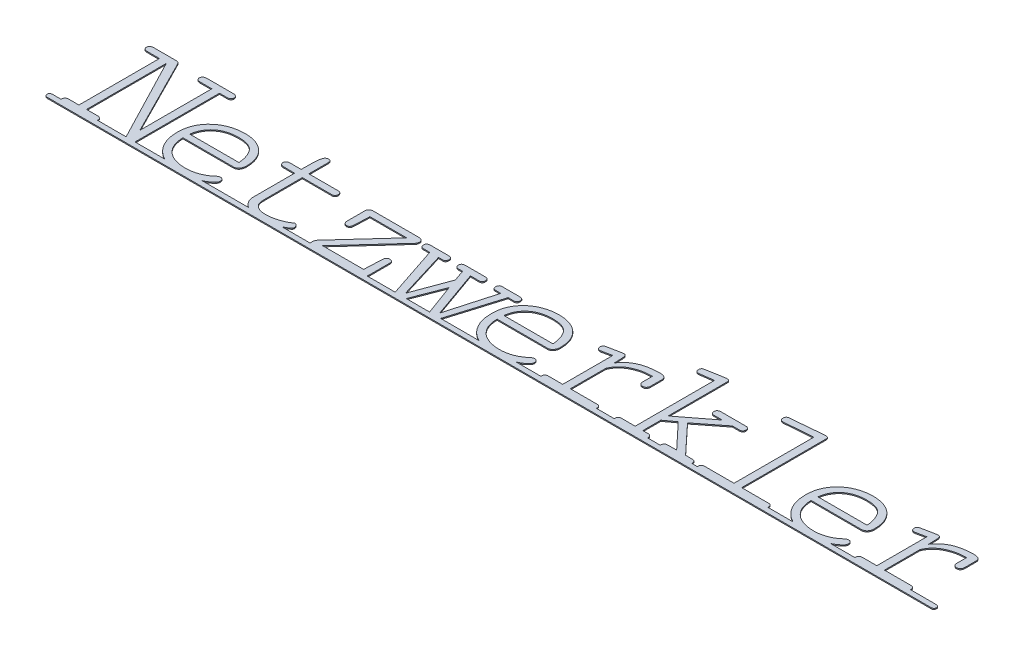
from build123d import *

# Parameters (mm, degrees)
AUFSATZ_LINEAR_AUSTRAGEN1_DEPTH    = 1
AUFSATZ_LINEAR_AUSTRAGEN1_2_DEPTH  = 1
AUFSATZ_LINEAR_AUSTRAGEN1_3_DEPTH  = 1
AUFSATZ_LINEAR_AUSTRAGEN1_4_DEPTH  = 1
AUFSATZ_LINEAR_AUSTRAGEN1_5_DEPTH  = 1
AUFSATZ_LINEAR_AUSTRAGEN1_6_DEPTH  = 1
AUFSATZ_LINEAR_AUSTRAGEN1_7_DEPTH  = 1
AUFSATZ_LINEAR_AUSTRAGEN1_8_DEPTH  = 1
AUFSATZ_LINEAR_AUSTRAGEN1_9_DEPTH  = 1
AUFSATZ_LINEAR_AUSTRAGEN1_10_DEPTH = 1
AUFSATZ_LINEAR_AUSTRAGEN1_11_DEPTH = 1
AUFSATZ_LINEAR_AUSTRAGEN3_DEPTH    = 1


with BuildPart() as part:
    # Skizze2 → Aufsatz-Linear austragen1 (new body)
    with BuildSketch(Plane(origin=(0, 0, 0), x_dir=(1, 0, 0), z_dir=(0, 1, 0))):
        with BuildLine():
            Line((21.819556452, 6.282762097), (12.179939516, 6.282762097))
            add(Edge.make_bspline(
                [(12.179939516, 6.282762097), (11.645265853, 6.252695795), (10.635808937, 6.19593101), (9.396362367, 5.421695162), (8.569459607, 4.373908894), (8.465197041, 3.550556393), (8.414818548, 3.152721774)],
                knots=[0, 0, 0, 0, 1.163915041, 2.197456445, 3.129031336, 4, 4, 4, 4], degree=3))
            add(Edge.make_bspline(
                [(8.414818548, 3.152721774), (8.461731539, 2.731819028), (8.556148513, 1.884711156), (9.384826392, 0.810331613), (10.671421694, 0.087707641), (11.692428496, 0.030906774), (12.247983871, 0)],
                knots=[0, 0, 0, 0, 0.9015604, 1.814478327, 2.810802915, 4, 4, 4, 4], degree=3))
            Line((12.247983871, 0), (39.647177419, 0))
            add(Edge.make_bspline(
                [(39.647177419, 0), (40.202732794, 0.030906774), (41.223739596, 0.087707641), (42.510334898, 0.810331613), (43.339012777, 1.884711156), (43.433429751, 2.731819028), (43.480342742, 3.152721774)],
                knots=[0, 0, 0, 0, 1.189197085, 2.185521673, 3.0984396, 4, 4, 4, 4], degree=3))
            add(Edge.make_bspline(
                [(43.480342742, 3.152721774), (43.430075448, 3.550743147), (43.326043018, 4.37448215), (42.501419824, 5.413850496), (41.278251541, 6.201204681), (40.273538702, 6.254401599), (39.737903226, 6.282762097)],
                knots=[0, 0, 0, 0, 0.874083582, 1.808990141, 2.831922353, 4, 4, 4, 4], degree=3))
            Line((39.737903226, 6.282762097), (29.168346774, 6.282762097))
            Line((29.168346774, 6.282762097), (29.168346774, 82.923387097))
            Line((29.168346774, 82.923387097), (71.491935484, 1.474294355))
            add(Edge.make_bspline(
                [(71.491935484, 1.474294355), (71.742219087, 1.048617155), (72.233029237, 0.213857354), (73.318712485, -0.71190596), (74.522789088, -1.309205283), (75.372284684, -1.40552722), (75.778729839, -1.451612903)],
                knots=[0, 0, 0, 0, 1.083340728, 2.124448505, 3.102633586, 4, 4, 4, 4], degree=3))
            add(Edge.make_bspline(
                [(75.778729839, -1.451612903), (76.038723219, -1.444027576), (76.549277302, -1.429132121), (77.255157475, -1.148401844), (77.924396552, -0.7910496), (78.488850958, -0.226111358), (78.969543803, 0.477158807), (79.306338917, 1.337272053), (79.512367884, 2.33401716), (79.532908058, 3.045733384), (79.543850806, 3.424899194)],
                knots=[0, 0, 0, 0, 0.894329064, 1.756211463, 2.601200456, 3.509242349, 4.490331309, 5.536444168, 6.687544121, 8, 8, 8, 8], degree=3))
            Line((79.543850806, 3.424899194), (79.543850806, 83.717237903))
            Line((79.543850806, 83.717237903), (86.892641129, 83.717237903))
            add(Edge.make_bspline(
                [(86.892641129, 83.717237903), (87.41842002, 83.749609872), (88.396829872, 83.809850123), (89.618686185, 84.535892322), (90.412980319, 85.570407315), (90.516406647, 86.381959709), (90.56703629, 86.779233871)],
                knots=[0, 0, 0, 0, 1.172493546, 2.181866286, 3.109980388, 4, 4, 4, 4], degree=3))
            add(Edge.make_bspline(
                [(90.56703629, 86.779233871), (90.521917476, 87.202181101), (90.429475524, 88.068739045), (89.544488696, 89.124187501), (88.296652159, 89.919051459), (87.277341749, 89.971849439), (86.733870968, 90)],
                knots=[0, 0, 0, 0, 0.897788018, 1.839438313, 2.848042621, 4, 4, 4, 4], degree=3))
            Line((86.733870968, 90), (60.945060484, 90))
            add(Edge.make_bspline(
                [(60.945060484, 90), (60.388572277, 89.970356917), (59.344950063, 89.914765119), (58.045158816, 89.147417698), (57.190851628, 88.057109377), (57.07709516, 87.200410548), (57.021169355, 86.779233871)],
                knots=[0, 0, 0, 0, 1.168472526, 2.191320264, 3.110803358, 4, 4, 4, 4], degree=3))
            add(Edge.make_bspline(
                [(57.021169355, 86.779233871), (57.070670181, 86.38128786), (57.17235425, 85.563831399), (58.000151315, 84.527256131), (59.256238851, 83.815171978), (60.253821701, 83.751319647), (60.786290323, 83.717237903)],
                knots=[0, 0, 0, 0, 0.877608716, 1.802774489, 2.827211556, 4, 4, 4, 4], degree=3))
            Line((60.786290323, 83.717237903), (72.195060484, 83.717237903))
            Line((72.195060484, 83.717237903), (72.195060484, 14.584173387))
            Line((72.195060484, 14.584173387), (34.974798387, 88.140120968))
            add(Edge.make_bspline(
                [(34.974798387, 88.140120968), (34.818638086, 88.439541393), (34.530511621, 88.991992612), (33.840159642, 89.622671689), (32.937114371, 89.951152977), (32.278577647, 89.982557041), (31.912802419, 90)],
                knots=[0, 0, 0, 0, 1.052313138, 1.941589905, 2.856684229, 4, 4, 4, 4], degree=3))
            Line((31.912802419, 90), (9.957157258, 90))
            add(Edge.make_bspline(
                [(9.957157258, 90), (9.415255524, 89.969679628), (8.392311067, 89.912444054), (7.124450111, 89.139127656), (6.265421608, 88.06034797), (6.170545961, 87.200934761), (6.123991935, 86.779233871)],
                knots=[0, 0, 0, 0, 1.150747229, 2.172258226, 3.103155123, 4, 4, 4, 4], degree=3))
            add(Edge.make_bspline(
                [(6.123991935, 86.779233871), (6.173393449, 86.381107973), (6.274873513, 85.56328199), (7.100037501, 84.535037725), (8.340450628, 83.809925432), (9.333067986, 83.749634209), (9.866431452, 83.717237903)],
                knots=[0, 0, 0, 0, 0.880824776, 1.809380884, 2.822913789, 4, 4, 4, 4], degree=3))
            Line((9.866431452, 83.717237903), (21.819556452, 83.717237903))
            Line((21.819556452, 83.717237903), (21.819556452, 6.282762097))
        make_face()
    extrude(amount=AUFSATZ_LINEAR_AUSTRAGEN1_DEPTH)



with BuildPart() as body_2:
    # Skizze2 → Aufsatz-Linear austragen1 2 (new body)
    with BuildSketch(Plane(origin=(0, 0, 0), x_dir=(1, 0, 0), z_dir=(0, 1, 0))):
        with BuildLine():
            add(Edge.make_bspline(
                [(91.723790323, 31.186995968), (91.772864812, 29.557899597), (91.868251557, 26.391403126), (92.69811115, 21.820272208), (94.063596474, 17.588791012), (95.975580248, 13.715077511), (98.38340923, 10.229155345), (101.261765132, 7.177150843), (104.55666121, 4.544102829), (108.280959303, 2.365961435), (112.368567164, 0.64474108), (116.781874176, -0.575943451), (121.487404494, -1.311863251), (124.722592019, -1.404251733), (126.381048387, -1.451612903)],
                knots=[0, 0, 0, 0, 1.091518764, 2.121599665, 3.102620066, 4.063796307, 5.007287007, 5.932476585, 6.866607136, 7.825495065, 8.815899445, 9.831776676, 10.888502211, 12, 12, 12, 12], degree=3))
            add(Edge.make_bspline(
                [(126.381048387, -1.451612903), (127.486504315, -1.419726848), (129.75244471, -1.35436748), (133.194495001, -0.847698415), (136.757562018, -0.072111471), (140.348623515, 0.990079711), (143.797343523, 2.308039154), (146.906970793, 3.861959613), (149.589435987, 5.652717999), (151.083588878, 7.070609999), (151.806955645, 7.757056452)],
                knots=[0, 0, 0, 0, 0.959260595, 1.966272266, 3.014093297, 4.122943806, 5.213721629, 6.214555519, 7.135609743, 8, 8, 8, 8], degree=3))
            add(Edge.make_bspline(
                [(151.806955645, 7.757056452), (152.212918187, 8.254261514), (152.974124834, 9.186553928), (153.121667957, 10.376928926), (153.190524194, 10.932459677)],
                knots=[0, 0, 0, 0, 1.066629001, 2, 2, 2, 2], degree=3))
            add(Edge.make_bspline(
                [(153.190524194, 10.932459677), (153.157792058, 11.366803518), (153.093188699, 12.224067195), (152.387386113, 13.302441), (151.385313128, 14.110694865), (150.551314454, 14.199123641), (150.128528226, 14.243951613)],
                knots=[0, 0, 0, 0, 1.028187244, 2.029331365, 3.000991744, 4, 4, 4, 4], degree=3))
            add(Edge.make_bspline(
                [(150.128528226, 14.243951613), (149.59175222, 14.177008193), (148.43260266, 14.032446152), (147.484736943, 13.343630818), (146.975806452, 12.973790323)],
                knots=[0, 0, 0, 0, 0.926154873, 2, 2, 2, 2], degree=3))
            add(Edge.make_bspline(
                [(146.975806452, 12.973790323), (146.241593947, 12.320644746), (144.782748271, 11.022875241), (142.341470637, 9.39756482), (139.780896968, 7.984122466), (137.08418884, 6.8264824), (134.304788445, 5.957583891), (131.48520979, 5.309827618), (128.637604925, 4.916456221), (126.722450174, 4.85951001), (125.768649194, 4.831149194)],
                knots=[0, 0, 0, 0, 1.013539612, 2.013855485, 3.020033019, 4.030712624, 5.038009999, 6.022761418, 7.015279524, 8, 8, 8, 8], degree=3))
            add(Edge.make_bspline(
                [(125.768649194, 4.831149194), (124.807549787, 4.845217311), (122.933464301, 4.872649286), (120.197948797, 5.183721928), (117.599787746, 5.645775489), (115.143590853, 6.333311277), (112.820249183, 7.194748347), (110.627196111, 8.238886578), (108.577873704, 9.487055296), (106.694463695, 10.94242071), (104.98090073, 12.57668086), (103.485033957, 14.403611956), (102.167618323, 16.390694689), (101.111170115, 18.577442335), (100.266242553, 20.943510981), (99.636780488, 23.480783167), (99.226905987, 26.200157982), (99.124977875, 28.070690791), (99.072580645, 29.032258065)],
                knots=[0, 0, 0, 0, 1.13417738, 2.211577025, 3.246273848, 4.246794185, 5.218387413, 6.168587881, 7.110069762, 8.045608957, 8.973623357, 9.899359785, 10.827760455, 11.781852031, 12.758761032, 13.789252614, 14.863541806, 16, 16, 16, 16], degree=3))
            Line((99.072580645, 29.032258065), (147.202620968, 29.032258065))
            add(Edge.make_bspline(
                [(147.202620968, 29.032258065), (147.628539126, 29.051386302), (148.459377098, 29.088699728), (149.638798144, 29.457098602), (150.663375812, 30.093254056), (151.53317954, 30.947601785), (152.234867306, 31.990420437), (152.724072591, 33.189262675), (153.068797206, 34.509664118), (153.089164463, 35.441105588), (153.099798387, 35.927419355)],
                knots=[0, 0, 0, 0, 1.001547663, 1.953717663, 2.873336758, 3.818146233, 4.806296796, 5.812112773, 6.857684876, 8, 8, 8, 8], degree=3))
            add(Edge.make_bspline(
                [(153.099798387, 35.927419355), (153.057392912, 37.291071945), (152.975349002, 39.929396082), (152.312213671, 43.730466434), (151.206142309, 47.219425913), (149.628699627, 50.370620724), (147.657342691, 53.169198141), (145.384357402, 55.664086689), (142.71485747, 57.732854383), (139.747995785, 59.43517571), (136.515654306, 60.778277188), (133.045377624, 61.713601509), (129.367029548, 62.335536675), (126.837335501, 62.390967658), (125.541834677, 62.419354839)],
                knots=[0, 0, 0, 0, 1.136615262, 2.199064119, 3.205959774, 4.178720204, 5.124966522, 6.052951885, 6.982499425, 7.928745743, 8.898231564, 9.892473855, 10.920698786, 12, 12, 12, 12], degree=3))
            add(Edge.make_bspline(
                [(125.541834677, 62.419354839), (124.019272925, 62.379398166), (121.025308599, 62.300827394), (116.634727229, 61.570966376), (112.442504553, 60.40296992), (108.495420173, 58.737150667), (104.82599316, 56.673704515), (101.554345546, 54.114894312), (98.649840031, 51.176046664), (96.164210775, 47.834679928), (94.18718065, 44.118705478), (92.737962668, 40.082630792), (91.895140947, 35.727813296), (91.781843928, 32.725425253), (91.723790323, 31.186995968)],
                knots=[0, 0, 0, 0, 1.061622308, 2.087573335, 3.096222785, 4.091611373, 5.0697979, 6.024736357, 6.979674813, 7.945046897, 8.919713757, 9.90583357, 10.926945179, 12, 12, 12, 12], degree=3))
        make_face()
        with BuildLine():
            add(Edge.make_bspline(
                [(125.700604839, 56.136592742), (126.654114435, 56.122787092), (128.490508842, 56.096198353), (131.122573102, 55.794321401), (133.525827277, 55.329366754), (135.688543536, 54.663937185), (137.59653353, 53.764711132), (139.269404734, 52.701852407), (140.709860639, 51.437159091), (142.26142264, 49.474189758), (143.820670972, 46.743948465), (145.233085764, 43.19032216), (146.202453959, 39.352269151), (146.458995329, 36.681285781), (146.590221774, 35.315020161)],
                knots=[0, 0, 0, 0, 1.02262648, 1.969508808, 2.838136608, 3.646288536, 4.390207712, 5.094504686, 5.766822338, 6.435754708, 7.769999364, 9.124216948, 10.528974925, 12, 12, 12, 12], degree=3))
            Line((146.590221774, 35.315020161), (99.299395161, 35.315020161))
            add(Edge.make_bspline(
                [(99.299395161, 35.315020161), (99.42978104, 36.119073922), (99.684096847, 37.687369384), (100.282856095, 39.95749635), (101.05055196, 42.093247157), (101.998866758, 44.097358194), (103.146381373, 45.942830891), (104.450282475, 47.660946153), (105.918320445, 49.248215903), (107.569154973, 50.680100698), (109.356527633, 51.982731263), (111.310205966, 53.087826694), (113.398504483, 54.013181309), (115.593495744, 54.827393126), (117.941683999, 55.394358417), (120.40915595, 55.838538629), (123.011863169, 56.079470192), (124.792912528, 56.11730874), (125.700604839, 56.136592742)],
                knots=[0, 0, 0, 0, 1.051325806, 2.05059608, 3.026463253, 3.978402172, 4.907694949, 5.827348407, 6.759917317, 7.693915922, 8.644953336, 9.611251269, 10.585652368, 11.592381936, 12.629469145, 13.70001935, 14.827840037, 16, 16, 16, 16], degree=3))
        make_face(mode=Mode.SUBTRACT)
    extrude(amount=AUFSATZ_LINEAR_AUSTRAGEN1_2_DEPTH)


with BuildPart() as body_3:
    # Skizze2 → Aufsatz-Linear austragen1 3 (new body)
    with BuildSketch(Plane(origin=(0, 0, 0), x_dir=(1, 0, 0), z_dir=(0, 1, 0))):
        with BuildLine():
            add(Edge.make_bspline(
                [(218.036794355, 53.233366935), (218.481897699, 53.266579106), (219.323982658, 53.32941276), (220.34484147, 54.09575225), (220.991405802, 55.151189677), (221.062494633, 55.96869604), (221.098790323, 56.38608871)],
                knots=[0, 0, 0, 0, 1.068175882, 2.020867414, 2.989518037, 4, 4, 4, 4], degree=3))
            add(Edge.make_bspline(
                [(221.098790323, 56.38608871), (221.059950405, 56.781125934), (220.981752681, 57.576467778), (220.332257526, 58.596251328), (219.3732654, 59.425005047), (218.537693256, 59.485032689), (218.10483871, 59.516129032)],
                knots=[0, 0, 0, 0, 0.97631331, 1.965644705, 2.946135358, 4, 4, 4, 4], degree=3))
            Line((218.10483871, 59.516129032), (189.616935484, 59.516129032))
            Line((189.616935484, 59.516129032), (189.616935484, 77.842741935))
            add(Edge.make_bspline(
                [(189.616935484, 77.842741935), (189.596272467, 78.335987115), (189.559381985, 79.216596747), (189.23317957, 80.247801341), (188.744868289, 80.825974886), (188.234412725, 81.092140052), (187.604711431, 81.286332424), (187.131510572, 81.288911042), (186.872479839, 81.290322581)],
                knots=[0, 0, 0, 0, 1.735936346, 3.099234069, 3.702153928, 4.345368629, 5.094252751, 6, 6, 6, 6], degree=3))
            add(Edge.make_bspline(
                [(186.872479839, 81.290322581), (186.529055735, 81.27195597), (185.865891199, 81.23648937), (184.943579015, 80.864693351), (184.207723011, 80.204774499), (183.636137558, 79.309057588), (183.218569238, 78.160493513), (182.890798787, 76.75815555), (182.617161381, 75.091988999), (182.47202528, 73.081843641), (182.393576061, 70.607925254), (182.326174512, 67.515396224), (182.284095877, 63.742549387), (182.273737801, 60.99799641), (182.268145161, 59.516129032)],
                knots=[0, 0, 0, 0, 0.51510725, 0.994690986, 1.462387448, 1.979876275, 2.577781804, 3.292441471, 4.145323355, 5.11562637, 6.322427182, 7.870050544, 9.770115052, 12, 12, 12, 12], degree=3))
            Line((182.268145161, 59.516129032), (171.018145161, 59.516129032))
            add(Edge.make_bspline(
                [(171.018145161, 59.516129032), (170.560550453, 59.479310653), (169.693584884, 59.409554018), (168.614539232, 58.70151053), (167.932351885, 57.688368519), (167.857366308, 56.909613313), (167.820060484, 56.522177419)],
                knots=[0, 0, 0, 0, 1.110783407, 2.104506348, 3.056979302, 4, 4, 4, 4], degree=3))
            add(Edge.make_bspline(
                [(167.820060484, 56.522177419), (167.863693309, 56.103908618), (167.951626573, 55.260971203), (168.683988517, 54.155025652), (169.855051158, 53.338213015), (170.822096272, 53.269735007), (171.335685484, 53.233366935)],
                knots=[0, 0, 0, 0, 0.928207431, 1.870617101, 2.869103345, 4, 4, 4, 4], degree=3))
            Line((171.335685484, 53.233366935), (182.268145161, 53.233366935))
            Line((182.268145161, 53.233366935), (182.268145161, 12.905745968))
            add(Edge.make_bspline(
                [(182.268145161, 12.905745968), (182.307307262, 12.282946582), (182.385907418, 11.03295927), (182.896788752, 9.186027115), (183.793728271, 7.427153245), (184.962490597, 5.726996468), (186.450131437, 4.174920981), (188.166155381, 2.752618679), (190.121224405, 1.512818378), (192.274941621, 0.456118874), (194.570467719, -0.417523605), (196.992008241, -0.977681078), (199.476049891, -1.403854841), (201.167428923, -1.435561439), (202.023689516, -1.451612903)],
                knots=[0, 0, 0, 0, 0.834967083, 1.675817741, 2.546020697, 3.470920887, 4.431607291, 5.41777436, 6.452328292, 7.526480059, 8.629595491, 9.735686291, 10.853691241, 12, 12, 12, 12], degree=3))
            add(Edge.make_bspline(
                [(202.023689516, -1.451612903), (203.744007539, -1.395794861), (207.214450496, -1.283191652), (211.49590194, -0.49326096), (214.847620293, 0.316151365), (217.207617599, 1.096184994), (219.440674722, 1.853962157), (221.463900694, 2.775614091), (223.279552653, 3.693284107), (224.811781489, 4.659478197), (226.085976908, 5.588006436), (226.755004674, 6.295985708), (227.064012097, 6.622983871)],
                knots=[0, 0, 0, 0, 1.919222848, 3.871698912, 4.846174639, 5.767161075, 6.645541626, 7.476873441, 8.247032903, 8.914504436, 9.498636374, 10, 10, 10, 10], degree=3))
            add(Edge.make_bspline(
                [(227.064012097, 6.622983871), (227.179337446, 6.806423355), (227.402326067, 7.161114826), (227.434205001, 7.578308587), (227.449596774, 7.779737903)],
                knots=[0, 0, 0, 0, 1.034360844, 2, 2, 2, 2], degree=3))
            add(Edge.make_bspline(
                [(227.449596774, 7.779737903), (227.392235427, 8.231833647), (227.269582601, 9.198526769), (226.394293673, 10.375533096), (225.463423047, 11.457633429), (224.601501939, 11.629373351), (224.228830645, 11.703629032)],
                knots=[0, 0, 0, 0, 0.986862134, 2.110156645, 3.182883024, 4, 4, 4, 4], degree=3))
            add(Edge.make_bspline(
                [(224.228830645, 11.703629032), (224.063114164, 11.698746241), (223.745717053, 11.689394222), (223.504765205, 11.484165355), (223.389616935, 11.38608871)],
                knots=[0, 0, 0, 0, 1.044221739, 2, 2, 2, 2], degree=3))
            add(Edge.make_bspline(
                [(223.389616935, 11.38608871), (222.741311822, 10.924789206), (221.405880229, 9.974566976), (219.137688723, 8.796167266), (216.653820507, 7.645064744), (213.930192329, 6.68325144), (211.114380105, 5.869137534), (208.294249136, 5.281434335), (205.527434321, 4.893847732), (203.695783865, 4.851820784), (202.794858871, 4.831149194)],
                knots=[0, 0, 0, 0, 0.869701391, 1.791481651, 2.791171894, 3.864177575, 4.948352767, 5.996575565, 7.014585375, 8, 8, 8, 8], degree=3))
            add(Edge.make_bspline(
                [(202.794858871, 4.831149194), (201.854516874, 4.855378315), (200.057407272, 4.901683155), (197.510186485, 5.421972884), (195.222926861, 6.202010169), (193.22925247, 7.327399372), (191.571232009, 8.824751898), (190.420196, 10.759234574), (189.725666084, 13.048434341), (189.654485929, 14.692279956), (189.616935484, 15.559475806)],
                knots=[0, 0, 0, 0, 1.167270286, 2.230797568, 3.217685499, 4.160773054, 5.058564122, 5.961212261, 6.924456012, 8, 8, 8, 8], degree=3))
            Line((189.616935484, 15.559475806), (189.616935484, 53.233366935))
            Line((189.616935484, 53.233366935), (218.036794355, 53.233366935))
        make_face()
    extrude(amount=AUFSATZ_LINEAR_AUSTRAGEN1_3_DEPTH)


with BuildPart() as body_4:
    # Skizze2 → Aufsatz-Linear austragen1 4 (new body)
    with BuildSketch(Plane(origin=(0, 0, 0), x_dir=(1, 0, 0), z_dir=(0, 1, 0))):
        with BuildLine():
            add(Edge.make_bspline(
                [(250.87953629, 59.516129032), (250.427001381, 59.462653491), (249.497500387, 59.352815405), (248.363195788, 58.475956418), (247.507425162, 57.331017111), (247.395821383, 56.407086423), (247.341229839, 55.955141129)],
                knots=[0, 0, 0, 0, 0.976007479, 2.004707044, 3.023992521, 4, 4, 4, 4], degree=3))
            Line((247.341229839, 55.955141129), (247.341229839, 38.467741935))
            add(Edge.make_bspline(
                [(247.341229839, 38.467741935), (247.386266164, 37.917553718), (247.471213474, 36.879791218), (248.298727668, 35.586628), (249.46160001, 34.767244184), (250.354480088, 34.647474286), (250.788810484, 34.58921371)],
                knots=[0, 0, 0, 0, 1.135956358, 2.142635687, 3.096508256, 4, 4, 4, 4], degree=3))
            add(Edge.make_bspline(
                [(250.788810484, 34.58921371), (251.210347912, 34.627217524), (252.045022938, 34.702467863), (253.088801467, 35.498504758), (253.862381745, 36.632789086), (253.959038261, 37.569632671), (254.009576613, 38.059475806)],
                knots=[0, 0, 0, 0, 0.949327158, 1.879737403, 2.891387959, 4, 4, 4, 4], degree=3))
            Line((254.009576613, 38.059475806), (254.621975806, 53.233366935))
            Line((254.621975806, 53.233366935), (289.914314516, 53.233366935))
            Line((289.914314516, 53.233366935), (249.04233871, 8.392137097))
            add(Edge.make_bspline(
                [(249.04233871, 8.392137097), (248.841623032, 8.134786146), (248.436216723, 7.614987691), (248.034250818, 6.681667507), (247.777535617, 5.646374191), (247.744163675, 4.915994645), (247.726814516, 4.536290323)],
                knots=[0, 0, 0, 0, 0.938300361, 1.895182731, 2.905763147, 4, 4, 4, 4], degree=3))
            add(Edge.make_bspline(
                [(247.726814516, 4.536290323), (247.738311712, 4.209815227), (247.760484705, 3.580189513), (247.972457386, 2.694186912), (248.285935441, 1.890250779), (248.768057427, 1.209394182), (249.383943245, 0.638825036), (250.169263277, 0.295825707), (251.041965969, 0.016494231), (251.67821381, 0.005693536), (252.013608871, 0)],
                knots=[0, 0, 0, 0, 1.101783492, 2.124851871, 3.064708809, 4.000734557, 4.924110726, 5.861531445, 6.872716348, 8, 8, 8, 8], degree=3))
            Line((252.013608871, 0), (298.941532258, 0))
            add(Edge.make_bspline(
                [(298.941532258, 0), (299.423187714, 0.054789565), (300.408519976, 0.16687368), (301.64884884, 1.015438803), (302.665604065, 2.123917703), (302.785617442, 3.082185797), (302.842741935, 3.538306452)],
                knots=[0, 0, 0, 0, 0.994245304, 2.033947633, 3.064189762, 4, 4, 4, 4], degree=3))
            Line((302.842741935, 3.538306452), (302.842741935, 24.223790323))
            add(Edge.make_bspline(
                [(302.842741935, 24.223790323), (302.81296245, 24.693373448), (302.75683236, 25.57847077), (301.962005843, 26.622190378), (300.942310777, 27.347455201), (300.125286848, 27.411974926), (299.712701613, 27.444556452)],
                knots=[0, 0, 0, 0, 1.100417818, 2.074130887, 3.02746403, 4, 4, 4, 4], degree=3))
            add(Edge.make_bspline(
                [(299.712701613, 27.444556452), (299.295176167, 27.407025355), (298.46425548, 27.332334422), (297.390907995, 26.681337503), (296.542894621, 25.741593338), (296.40333053, 24.927786736), (296.333165323, 24.518649194)],
                knots=[0, 0, 0, 0, 1.013496614, 2.016967615, 3.003039551, 4, 4, 4, 4], degree=3))
            Line((296.333165323, 24.518649194), (295.493951613, 6.282762097))
            Line((295.493951613, 6.282762097), (256.07358871, 6.282762097))
            Line((256.07358871, 6.282762097), (298.329133065, 52.575604839))
            add(Edge.make_bspline(
                [(298.329133065, 52.575604839), (298.530053228, 52.80199549), (298.945316997, 53.269901915), (299.351329488, 54.151340422), (299.659355988, 55.080673843), (299.695440365, 55.733555722), (299.712701613, 56.045866935)],
                knots=[0, 0, 0, 0, 0.945802782, 1.954794493, 3.02165976, 4, 4, 4, 4], degree=3))
            add(Edge.make_bspline(
                [(299.712701613, 56.045866935), (299.664655841, 56.514169673), (299.568397759, 57.452398385), (298.789771617, 58.424136134), (297.950080872, 58.994609205), (297.119045245, 59.30515228), (296.128619181, 59.477357702), (295.419099417, 59.502634842), (295.040322581, 59.516129032)],
                knots=[0, 0, 0, 0, 1.270869024, 2.546143154, 3.248949409, 4.051213375, 4.959641056, 6, 6, 6, 6], degree=3))
            Line((295.040322581, 59.516129032), (250.87953629, 59.516129032))
        make_face()
    extrude(amount=AUFSATZ_LINEAR_AUSTRAGEN1_4_DEPTH)


with BuildPart() as body_5:
    # Skizze2 → Aufsatz-Linear austragen1 5 (new body)
    with BuildSketch(Plane(origin=(0, 0, 0), x_dir=(1, 0, 0), z_dir=(0, 1, 0))):
        with BuildLine():
            add(Edge.make_bspline(
                [(341.060987903, 58.540826613), (340.541872448, 58.507964438), (339.606445302, 58.448747996), (338.341709797, 57.875451447), (337.625375425, 56.737872064), (337.558509045, 55.873776363), (337.522681452, 55.41078629)],
                knots=[0, 0, 0, 0, 1.157067938, 2.084994289, 2.973923106, 4, 4, 4, 4], degree=3))
            add(Edge.make_bspline(
                [(337.522681452, 55.41078629), (337.549058508, 54.939434151), (337.597155659, 54.079948732), (338.27166694, 52.977228568), (339.39841372, 52.338836317), (340.26576839, 52.286750046), (340.743447581, 52.258064516)],
                knots=[0, 0, 0, 0, 1.090407833, 1.988300372, 2.892094453, 4, 4, 4, 4], degree=3))
            Line((340.743447581, 52.258064516), (344.644657258, 52.258064516))
            Line((344.644657258, 52.258064516), (348.409778226, 41.507056452))
            Line((348.409778226, 41.507056452), (335.458669355, 6.509576613))
            Line((335.458669355, 6.509576613), (321.532258065, 52.258064516))
            Line((321.532258065, 52.258064516), (325.524193548, 52.258064516))
            add(Edge.make_bspline(
                [(325.524193548, 52.258064516), (325.957798233, 52.278338873), (326.757086198, 52.315711737), (327.774687947, 52.970461394), (328.361201641, 54.042832014), (328.40387491, 54.865927688), (328.427419355, 55.320060484)],
                knots=[0, 0, 0, 0, 1.066378125, 1.96571493, 2.877608528, 4, 4, 4, 4], degree=3))
            add(Edge.make_bspline(
                [(328.427419355, 55.320060484), (328.404055522, 55.795573833), (328.361452367, 56.662656245), (327.772729803, 57.802828561), (326.699450218, 58.458484413), (325.88126206, 58.511701116), (325.433467742, 58.540826613)],
                knots=[0, 0, 0, 0, 1.130272108, 2.061012731, 2.938792414, 4, 4, 4, 4], degree=3))
            Line((325.433467742, 58.540826613), (307.447076613, 58.540826613))
            add(Edge.make_bspline(
                [(307.447076613, 58.540826613), (306.927099883, 58.509748639), (305.996858803, 58.454149982), (304.747620816, 57.867316167), (304.033877087, 56.738496142), (303.967185533, 55.873994089), (303.931451613, 55.41078629)],
                knots=[0, 0, 0, 0, 1.161421444, 2.077789017, 2.970062458, 4, 4, 4, 4], degree=3))
            add(Edge.make_bspline(
                [(303.931451613, 55.41078629), (303.957828669, 54.939434151), (304.00592582, 54.079948732), (304.680437102, 52.977228568), (305.807183881, 52.338836317), (306.674538551, 52.286750046), (307.152217742, 52.258064516)],
                knots=[0, 0, 0, 0, 1.090407833, 1.988300372, 2.892094453, 4, 4, 4, 4], degree=3))
            Line((307.152217742, 52.258064516), (313.117439516, 52.258064516))
            Line((313.117439516, 52.258064516), (329.107862903, 4.105342742))
            add(Edge.make_bspline(
                [(329.107862903, 4.105342742), (329.290424299, 3.57007943), (329.629339774, 2.576391693), (330.294119994, 1.296590283), (330.937467487, 0.266373153), (331.91477114, -0.648113076), (333.374466275, -1.317654032), (334.604868144, -1.40639327), (335.231854839, -1.451612903)],
                knots=[0, 0, 0, 0, 1.129369899, 2.096614868, 2.881039036, 3.544441927, 4.748699691, 6, 6, 6, 6], degree=3))
            add(Edge.make_bspline(
                [(335.231854839, -1.451612903), (335.798973931, -1.414857692), (336.885764153, -1.344422391), (338.155874565, -0.712977091), (338.980318861, 0.129612361), (339.580399046, 1.061391497), (340.184312976, 2.266722828), (340.546921148, 3.179621953), (340.743447581, 3.674395161)],
                knots=[0, 0, 0, 0, 1.246597113, 2.388897802, 3.026343943, 3.831999632, 4.824986828, 6, 6, 6, 6], degree=3))
            Line((340.743447581, 3.674395161), (351.766633065, 32.275705645))
            Line((351.766633065, 32.275705645), (362.109375, 4.059979839))
            add(Edge.make_bspline(
                [(362.109375, 4.059979839), (362.316271926, 3.53241887), (362.696350678, 2.563266166), (363.39417505, 1.306887174), (364.052071808, 0.29363648), (365.014720426, -0.609411513), (366.424652829, -1.296247727), (367.620427911, -1.398962582), (368.233366935, -1.451612903)],
                knots=[0, 0, 0, 0, 1.146757495, 2.106643955, 2.909961782, 3.582013304, 4.760570923, 6, 6, 6, 6], degree=3))
            add(Edge.make_bspline(
                [(368.233366935, -1.451612903), (368.822512706, -1.406223619), (369.953634479, -1.319079128), (371.28691069, -0.680313406), (372.131642882, 0.190741944), (372.748304082, 1.114389586), (373.265837252, 2.332413165), (373.577170749, 3.233909143), (373.744959677, 3.719758065)],
                knots=[0, 0, 0, 0, 1.284298162, 2.465769402, 3.119593921, 3.916437207, 4.877092346, 6, 6, 6, 6], degree=3))
            Line((373.744959677, 3.719758065), (388.442540323, 52.258064516))
            Line((388.442540323, 52.258064516), (393.727318548, 52.258064516))
            add(Edge.make_bspline(
                [(393.727318548, 52.258064516), (394.204290689, 52.287197647), (395.07036152, 52.340096658), (396.201747214, 52.9712422), (396.844812634, 54.088006477), (396.896773612, 54.940871942), (396.925403226, 55.41078629)],
                knots=[0, 0, 0, 0, 1.110481205, 2.016376424, 2.907057188, 4, 4, 4, 4], degree=3))
            add(Edge.make_bspline(
                [(396.925403226, 55.41078629), (396.889669305, 55.873994089), (396.822977752, 56.738496142), (396.109234023, 57.867316167), (394.859996036, 58.454149982), (393.929754956, 58.509748639), (393.409778226, 58.540826613)],
                knots=[0, 0, 0, 0, 1.029937542, 1.922210983, 2.838578556, 4, 4, 4, 4], degree=3))
            Line((393.409778226, 58.540826613), (376.489415323, 58.540826613))
            add(Edge.make_bspline(
                [(376.489415323, 58.540826613), (376.034218, 58.511479823), (375.202275541, 58.457844093), (374.109014525, 57.806104915), (373.487381342, 56.669397889), (373.448597218, 55.796630456), (373.427419355, 55.320060484)],
                knots=[0, 0, 0, 0, 1.067837307, 1.95163537, 2.88150149, 4, 4, 4, 4], degree=3))
            add(Edge.make_bspline(
                [(373.427419355, 55.320060484), (373.448801209, 54.864839908), (373.487735819, 54.035920414), (374.107235706, 52.967616819), (375.151390464, 52.31221379), (375.972487741, 52.277203944), (376.421370968, 52.258064516)],
                knots=[0, 0, 0, 0, 1.105070191, 2.012242572, 2.913318807, 4, 4, 4, 4], degree=3))
            Line((376.421370968, 52.258064516), (381.388608871, 52.258064516))
            Line((381.388608871, 52.258064516), (368.460181452, 6.509576613))
            Line((368.460181452, 6.509576613), (352.220262097, 52.258064516))
            Line((352.220262097, 52.258064516), (360.56703629, 52.258064516))
            add(Edge.make_bspline(
                [(360.56703629, 52.258064516), (360.999560278, 52.280159321), (361.803290277, 52.3212166), (362.838678937, 52.961847751), (363.426205096, 54.043726741), (363.469213949, 54.866245819), (363.492943548, 55.320060484)],
                knots=[0, 0, 0, 0, 1.062165779, 1.973750646, 2.882042135, 4, 4, 4, 4], degree=3))
            add(Edge.make_bspline(
                [(363.492943548, 55.320060484), (363.469579715, 55.795573833), (363.426976561, 56.662656245), (362.838253996, 57.802828561), (361.764974412, 58.458484413), (360.946786253, 58.511701116), (360.498991935, 58.540826613)],
                knots=[0, 0, 0, 0, 1.130272108, 2.061012731, 2.938792414, 4, 4, 4, 4], degree=3))
            Line((360.498991935, 58.540826613), (341.060987903, 58.540826613))
        make_face()
    extrude(amount=AUFSATZ_LINEAR_AUSTRAGEN1_5_DEPTH)


with BuildPart() as body_6:
    # Skizze2 → Aufsatz-Linear austragen1 6 (new body)
    with BuildSketch(Plane(origin=(0, 0, 0), x_dir=(1, 0, 0), z_dir=(0, 1, 0))):
        with BuildLine():
            add(Edge.make_bspline(
                [(393.659274194, 31.186995968), (393.708348683, 29.557899597), (393.803735428, 26.391403126), (394.633595021, 21.820272208), (395.999080345, 17.588791012), (397.911064119, 13.715077511), (400.318893101, 10.229155345), (403.197249003, 7.177150843), (406.492145081, 4.544102829), (410.216443174, 2.365961435), (414.304051035, 0.64474108), (418.717358047, -0.575943451), (423.422888365, -1.311863251), (426.65807589, -1.404251733), (428.316532258, -1.451612903)],
                knots=[0, 0, 0, 0, 1.091518764, 2.121599665, 3.102620066, 4.063796307, 5.007287007, 5.932476585, 6.866607136, 7.825495065, 8.815899445, 9.831776676, 10.888502211, 12, 12, 12, 12], degree=3))
            add(Edge.make_bspline(
                [(428.316532258, -1.451612903), (429.421988186, -1.419726848), (431.687928581, -1.35436748), (435.129978872, -0.847698415), (438.693045889, -0.072111471), (442.284107386, 0.990079711), (445.732827394, 2.308039154), (448.842454664, 3.861959613), (451.524919858, 5.652717999), (453.019072749, 7.070609999), (453.742439516, 7.757056452)],
                knots=[0, 0, 0, 0, 0.959260595, 1.966272266, 3.014093297, 4.122943806, 5.213721629, 6.214555519, 7.135609743, 8, 8, 8, 8], degree=3))
            add(Edge.make_bspline(
                [(453.742439516, 7.757056452), (454.148402058, 8.254261514), (454.909608705, 9.186553928), (455.057151828, 10.376928926), (455.126008065, 10.932459677)],
                knots=[0, 0, 0, 0, 1.066629001, 2, 2, 2, 2], degree=3))
            add(Edge.make_bspline(
                [(455.126008065, 10.932459677), (455.093275929, 11.366803518), (455.02867257, 12.224067195), (454.322869984, 13.302441), (453.320796999, 14.110694865), (452.486798325, 14.199123641), (452.064012097, 14.243951613)],
                knots=[0, 0, 0, 0, 1.028187244, 2.029331365, 3.000991744, 4, 4, 4, 4], degree=3))
            add(Edge.make_bspline(
                [(452.064012097, 14.243951613), (451.527236091, 14.177008193), (450.368086531, 14.032446152), (449.420220814, 13.343630818), (448.911290323, 12.973790323)],
                knots=[0, 0, 0, 0, 0.926154873, 2, 2, 2, 2], degree=3))
            add(Edge.make_bspline(
                [(448.911290323, 12.973790323), (448.177077818, 12.320644746), (446.718232142, 11.022875241), (444.276954508, 9.39756482), (441.716380839, 7.984122466), (439.019672711, 6.8264824), (436.240272316, 5.957583891), (433.420693661, 5.309827618), (430.573088796, 4.916456221), (428.657934045, 4.85951001), (427.704133065, 4.831149194)],
                knots=[0, 0, 0, 0, 1.013539612, 2.013855485, 3.020033019, 4.030712624, 5.038009999, 6.022761418, 7.015279524, 8, 8, 8, 8], degree=3))
            add(Edge.make_bspline(
                [(427.704133065, 4.831149194), (426.743033658, 4.845217311), (424.868948172, 4.872649286), (422.133432668, 5.183721928), (419.535271617, 5.645775489), (417.079074724, 6.333311277), (414.755733054, 7.194748347), (412.562679982, 8.238886578), (410.513357575, 9.487055296), (408.629947566, 10.94242071), (406.916384601, 12.57668086), (405.420517828, 14.403611956), (404.103102194, 16.390694689), (403.046653986, 18.577442335), (402.201726424, 20.943510981), (401.572264359, 23.480783167), (401.162389858, 26.200157982), (401.060461746, 28.070690791), (401.008064516, 29.032258065)],
                knots=[0, 0, 0, 0, 1.13417738, 2.211577025, 3.246273848, 4.246794185, 5.218387413, 6.168587881, 7.110069762, 8.045608957, 8.973623357, 9.899359785, 10.827760455, 11.781852031, 12.758761032, 13.789252614, 14.863541806, 16, 16, 16, 16], degree=3))
            Line((401.008064516, 29.032258065), (449.138104839, 29.032258065))
            add(Edge.make_bspline(
                [(449.138104839, 29.032258065), (449.564022997, 29.051386302), (450.394860969, 29.088699728), (451.574282015, 29.457098602), (452.598859683, 30.093254056), (453.468663411, 30.947601785), (454.170351177, 31.990420437), (454.659556462, 33.189262675), (455.004281077, 34.509664118), (455.024648334, 35.441105588), (455.035282258, 35.927419355)],
                knots=[0, 0, 0, 0, 1.001547663, 1.953717663, 2.873336758, 3.818146233, 4.806296796, 5.812112773, 6.857684876, 8, 8, 8, 8], degree=3))
            add(Edge.make_bspline(
                [(455.035282258, 35.927419355), (454.992876783, 37.291071945), (454.910832873, 39.929396082), (454.247697542, 43.730466434), (453.14162618, 47.219425913), (451.564183498, 50.370620724), (449.592826562, 53.169198141), (447.319841273, 55.664086689), (444.650341341, 57.732854383), (441.683479656, 59.43517571), (438.451138177, 60.778277188), (434.980861495, 61.713601509), (431.302513419, 62.335536675), (428.772819372, 62.390967658), (427.477318548, 62.419354839)],
                knots=[0, 0, 0, 0, 1.136615262, 2.199064119, 3.205959774, 4.178720204, 5.124966522, 6.052951885, 6.982499425, 7.928745743, 8.898231564, 9.892473855, 10.920698786, 12, 12, 12, 12], degree=3))
            add(Edge.make_bspline(
                [(427.477318548, 62.419354839), (425.954756796, 62.379398166), (422.96079247, 62.300827394), (418.5702111, 61.570966376), (414.377988424, 60.40296992), (410.430904044, 58.737150667), (406.761477031, 56.673704515), (403.489829417, 54.114894312), (400.585323902, 51.176046664), (398.099694646, 47.834679928), (396.122664521, 44.118705478), (394.673446539, 40.082630792), (393.830624818, 35.727813296), (393.717327799, 32.725425253), (393.659274194, 31.186995968)],
                knots=[0, 0, 0, 0, 1.061622308, 2.087573335, 3.096222785, 4.091611373, 5.0697979, 6.024736357, 6.979674813, 7.945046897, 8.919713757, 9.90583357, 10.926945179, 12, 12, 12, 12], degree=3))
        make_face()
        with BuildLine():
            add(Edge.make_bspline(
                [(427.63608871, 56.136592742), (428.589598306, 56.122787092), (430.425992713, 56.096198353), (433.058056973, 55.794321401), (435.461311148, 55.329366754), (437.624027407, 54.663937185), (439.532017401, 53.764711132), (441.204888605, 52.701852407), (442.64534451, 51.437159091), (444.196906511, 49.474189758), (445.756154843, 46.743948465), (447.168569635, 43.19032216), (448.13793783, 39.352269151), (448.3944792, 36.681285781), (448.525705645, 35.315020161)],
                knots=[0, 0, 0, 0, 1.02262648, 1.969508808, 2.838136608, 3.646288536, 4.390207712, 5.094504686, 5.766822338, 6.435754708, 7.769999364, 9.124216948, 10.528974925, 12, 12, 12, 12], degree=3))
            Line((448.525705645, 35.315020161), (401.234879032, 35.315020161))
            add(Edge.make_bspline(
                [(401.234879032, 35.315020161), (401.365264911, 36.119073922), (401.619580718, 37.687369384), (402.218339966, 39.95749635), (402.986035831, 42.093247157), (403.934350629, 44.097358194), (405.081865244, 45.942830891), (406.385766346, 47.660946153), (407.853804316, 49.248215903), (409.504638844, 50.680100698), (411.292011504, 51.982731263), (413.245689837, 53.087826694), (415.333988354, 54.013181309), (417.528979615, 54.827393126), (419.87716787, 55.394358417), (422.344639821, 55.838538629), (424.94734704, 56.079470192), (426.728396399, 56.11730874), (427.63608871, 56.136592742)],
                knots=[0, 0, 0, 0, 1.051325806, 2.05059608, 3.026463253, 3.978402172, 4.907694949, 5.827348407, 6.759917317, 7.693915922, 8.644953336, 9.611251269, 10.585652368, 11.592381936, 12.629469145, 13.70001935, 14.827840037, 16, 16, 16, 16], degree=3))
        make_face(mode=Mode.SUBTRACT)
    extrude(amount=AUFSATZ_LINEAR_AUSTRAGEN1_6_DEPTH)


with BuildPart() as body_7:
    # Skizze2 → Aufsatz-Linear austragen1 7 (new body)
    with BuildSketch(Plane(origin=(0, 0, 0), x_dir=(1, 0, 0), z_dir=(0, 1, 0))):
        with BuildLine():
            add(Edge.make_bspline(
                [(523.329133065, 46.905241935), (523.338576121, 46.600729378), (523.356298969, 46.029216344), (523.585130341, 45.231594461), (523.876705703, 44.50927002), (524.52921564, 43.774587856), (525.531526162, 43.077725162), (526.469883901, 42.96783327), (526.935483871, 42.913306452)],
                knots=[0, 0, 0, 0, 0.907297214, 1.702826926, 2.472202217, 3.210701635, 4.615989213, 6, 6, 6, 6], degree=3))
            add(Edge.make_bspline(
                [(526.935483871, 42.913306452), (527.425500285, 42.961856186), (528.409389936, 43.059337779), (529.444829289, 43.82831687), (530.076123859, 44.636984674), (530.443181949, 45.391836786), (530.642596148, 46.275167277), (530.665766591, 46.896689362), (530.677923387, 47.222782258)],
                knots=[0, 0, 0, 0, 1.365467258, 2.741681835, 3.469955938, 4.250797781, 5.08224916, 6, 6, 6, 6], degree=3))
            Line((530.677923387, 47.222782258), (530.677923387, 57.815020161))
            add(Edge.make_bspline(
                [(530.677923387, 57.815020161), (530.663350062, 58.172367708), (530.635193302, 58.862790015), (530.342279294, 59.823662167), (529.837869001, 60.639139771), (529.143142707, 61.312002371), (528.1987804, 61.829529623), (527.007363216, 62.165493262), (525.560727642, 62.396779526), (524.509703567, 62.411433222), (523.941532258, 62.419354839)],
                knots=[0, 0, 0, 0, 0.918472214, 1.774557321, 2.552689675, 3.365146704, 4.237029691, 5.29639774, 6.538464273, 8, 8, 8, 8], degree=3))
            add(Edge.make_bspline(
                [(523.941532258, 62.419354839), (522.230550576, 62.385970608), (518.93191467, 62.32160848), (514.177207604, 61.666634668), (509.80256368, 60.649690129), (505.815662078, 59.177353628), (502.236011807, 57.247845329), (499.036298173, 54.92661277), (496.2071041, 52.180890487), (494.696167824, 50.046136619), (493.933971774, 48.969254032)],
                knots=[0, 0, 0, 0, 1.194381133, 2.302671344, 3.345255974, 4.326114207, 5.261735061, 6.176437799, 7.080098923, 8, 8, 8, 8], degree=3))
            Line((493.933971774, 48.969254032), (493.639112903, 56.953125))
            add(Edge.make_bspline(
                [(493.639112903, 56.953125), (493.595820026, 57.582023499), (493.520221989, 58.680206259), (493.163512697, 59.962372304), (492.644198576, 60.669041512), (492.127097922, 61.039446516), (491.458747768, 61.226865441), (490.971212996, 61.250233984), (490.713205645, 61.262600806)],
                knots=[0, 0, 0, 0, 1.90834719, 3.332356479, 3.935828848, 4.525728466, 5.219803562, 6, 6, 6, 6], degree=3))
            add(Edge.make_bspline(
                [(490.713205645, 61.262600806), (490.439956709, 61.256069792), (489.850127013, 61.241972076), (489.275275405, 61.107800522), (488.966733871, 61.03578629)],
                knots=[0, 0, 0, 0, 0.926535023, 2, 2, 2, 2], degree=3))
            Line((488.966733871, 61.03578629), (475.87953629, 58.427419355))
            add(Edge.make_bspline(
                [(475.87953629, 58.427419355), (475.540053107, 58.324710928), (474.878524636, 58.124569796), (474.143637883, 57.394737883), (473.654409712, 56.506482285), (473.595848257, 55.840590373), (473.566028226, 55.501512097)],
                knots=[0, 0, 0, 0, 1.041424956, 2.029356072, 2.996530017, 4, 4, 4, 4], degree=3))
            add(Edge.make_bspline(
                [(473.566028226, 55.501512097), (473.607679898, 55.108988376), (473.691130518, 54.322553017), (474.295188207, 53.264510116), (475.33968551, 52.519451425), (476.184687234, 52.452146663), (476.628024194, 52.416834677)],
                knots=[0, 0, 0, 0, 0.967726389, 1.938874544, 2.91861393, 4, 4, 4, 4], degree=3))
            add(Edge.make_bspline(
                [(476.628024194, 52.416834677), (476.809793006, 52.420407381), (477.121090299, 52.426525995), (477.429596557, 52.467733074), (477.55796371, 52.484879032)],
                knots=[0, 0, 0, 0, 1.167814922, 2, 2, 2, 2], degree=3))
            Line((477.55796371, 52.484879032), (486.902721774, 54.412802419))
            Line((486.902721774, 54.412802419), (486.902721774, 6.282762097))
            Line((486.902721774, 6.282762097), (472.885584677, 6.282762097))
            add(Edge.make_bspline(
                [(472.885584677, 6.282762097), (472.417441709, 6.251025766), (471.528743989, 6.190779203), (470.471772193, 5.41873783), (469.770845014, 4.405900967), (469.700269148, 3.617023237), (469.664818548, 3.220766129)],
                knots=[0, 0, 0, 0, 1.113178694, 2.113199245, 3.052250836, 4, 4, 4, 4], degree=3))
            add(Edge.make_bspline(
                [(469.664818548, 3.220766129), (469.707642777, 2.802562829), (469.793291233, 1.966156229), (470.525180337, 0.870405297), (471.714994503, 0.115061302), (472.669223744, 0.040138971), (473.180443548, 0)],
                knots=[0, 0, 0, 0, 0.935854209, 1.871708418, 2.859786768, 4, 4, 4, 4], degree=3))
            Line((473.180443548, 0), (519.881552419, 0))
            add(Edge.make_bspline(
                [(519.881552419, 0), (520.326573002, 0.043558543), (521.184203248, 0.127503254), (522.220396117, 0.904085084), (522.927841444, 1.935864676), (522.998966534, 2.749045496), (523.034274194, 3.152721774)],
                knots=[0, 0, 0, 0, 1.064272387, 2.051033649, 3.032501181, 4, 4, 4, 4], degree=3))
            add(Edge.make_bspline(
                [(523.034274194, 3.152721774), (522.998649707, 3.563584041), (522.928815596, 4.368990762), (522.265514287, 5.398272214), (521.268641777, 6.191880045), (520.418985942, 6.251445485), (519.972278226, 6.282762097)],
                knots=[0, 0, 0, 0, 0.998052697, 1.956466717, 2.925609586, 4, 4, 4, 4], degree=3))
            Line((519.972278226, 6.282762097), (494.251512097, 6.282762097))
            Line((494.251512097, 6.282762097), (494.251512097, 40.372983871))
            add(Edge.make_bspline(
                [(494.251512097, 40.372983871), (494.518185375, 40.999405679), (495.04774867, 42.243362322), (496.070710586, 43.989124914), (497.18888149, 45.655446391), (498.498709122, 47.18313134), (499.955277714, 48.587559078), (501.551428484, 49.892178007), (503.303346205, 51.066007587), (505.841334093, 52.502202216), (509.288160012, 53.962217162), (513.708399868, 55.247618475), (518.426939281, 55.999134202), (521.670709623, 56.090090201), (523.329133065, 56.136592742)],
                knots=[0, 0, 0, 0, 0.696602981, 1.383323339, 2.068470252, 2.749623641, 3.439610484, 4.138619404, 4.858087316, 5.596677489, 7.122830654, 8.67894176, 10.302062028, 12, 12, 12, 12], degree=3))
            Line((523.329133065, 56.136592742), (523.329133065, 46.905241935))
        make_face()
    extrude(amount=AUFSATZ_LINEAR_AUSTRAGEN1_7_DEPTH)


with BuildPart() as body_8:
    # Skizze2 → Aufsatz-Linear austragen1 8 (new body)
    with BuildSketch(Plane(origin=(0, 0, 0), x_dir=(1, 0, 0), z_dir=(0, 1, 0))):
        with BuildLine():
            add(Edge.make_bspline(
                [(563.90625, 87.595766129), (563.882628486, 87.949537068), (563.83729442, 88.628489102), (563.160591496, 89.419675736), (562.250381062, 89.931495227), (561.540150593, 89.976190038), (561.161794355, 90)],
                knots=[0, 0, 0, 0, 1.012128414, 1.942462112, 2.903901864, 4, 4, 4, 4], degree=3))
            Line((561.161794355, 90), (560.231854839, 90))
            Line((560.231854839, 90), (542.313508065, 86.847278226))
            add(Edge.make_bspline(
                [(542.313508065, 86.847278226), (541.943733775, 86.765055372), (541.234108932, 86.607263493), (540.418846213, 85.862894898), (539.956417793, 84.896949044), (539.895163421, 84.190882196), (539.86391129, 83.830645161)],
                knots=[0, 0, 0, 0, 1.050726609, 2.016423868, 2.987974601, 4, 4, 4, 4], degree=3))
            add(Edge.make_bspline(
                [(539.86391129, 83.830645161), (539.902381463, 83.428968382), (539.980108042, 82.617405564), (540.645463572, 81.547952389), (541.711099287, 80.784871509), (542.573215062, 80.714247781), (543.016633065, 80.677923387)],
                knots=[0, 0, 0, 0, 0.963278202, 1.946243378, 2.943677071, 4, 4, 4, 4], degree=3))
            add(Edge.make_bspline(
                [(543.016633065, 80.677923387), (543.107658074, 80.683221646), (543.283197684, 80.693439214), (543.455399063, 80.72889658), (543.538306452, 80.745967742)],
                knots=[0, 0, 0, 0, 1.037087982, 2, 2, 2, 2], degree=3))
            Line((543.538306452, 80.745967742), (556.557459677, 82.537802419))
            Line((556.557459677, 82.537802419), (556.557459677, 6.282762097))
            Line((556.557459677, 6.282762097), (543.402217742, 6.282762097))
            add(Edge.make_bspline(
                [(543.402217742, 6.282762097), (542.934074774, 6.251025766), (542.045377054, 6.190779203), (540.988405257, 5.41873783), (540.287478079, 4.405900967), (540.216902213, 3.617023237), (540.181451613, 3.220766129)],
                knots=[0, 0, 0, 0, 1.113178694, 2.113199245, 3.052250836, 4, 4, 4, 4], degree=3))
            add(Edge.make_bspline(
                [(540.181451613, 3.220766129), (540.232028399, 2.801795648), (540.333513953, 1.961104603), (541.08825006, 0.876688842), (542.262380314, 0.122187331), (543.201137527, 0.042237143), (543.697076613, 0)],
                knots=[0, 0, 0, 0, 0.944047524, 1.894291685, 2.887568541, 4, 4, 4, 4], degree=3))
            Line((543.697076613, 0), (569.259072581, 0))
            add(Edge.make_bspline(
                [(569.259072581, 0), (569.704175925, 0.033212171), (570.546260884, 0.096045824), (571.567119696, 0.862385315), (572.213684028, 1.917822741), (572.284772859, 2.735329104), (572.321068548, 3.152721774)],
                knots=[0, 0, 0, 0, 1.068175882, 2.020867414, 2.989518037, 4, 4, 4, 4], degree=3))
            add(Edge.make_bspline(
                [(572.321068548, 3.152721774), (572.282234255, 3.5477624), (572.204047853, 4.343111093), (571.554467166, 5.362842904), (570.601685098, 6.186713437), (569.77459311, 6.250170518), (569.349798387, 6.282762097)],
                knots=[0, 0, 0, 0, 0.980860216, 1.974799146, 2.95985616, 4, 4, 4, 4], degree=3))
            Line((569.349798387, 6.282762097), (563.90625, 6.282762097))
            Line((563.90625, 6.282762097), (563.90625, 23.656754032))
            Line((563.90625, 23.656754032), (573.545866935, 30.688004032))
            Line((573.545866935, 30.688004032), (596.431451613, 6.282762097))
            Line((596.431451613, 6.282762097), (588.016633065, 6.282762097))
            add(Edge.make_bspline(
                [(588.016633065, 6.282762097), (587.504422562, 6.252596019), (586.547299421, 6.196227297), (585.379129886, 5.436604166), (584.623919131, 4.384110098), (584.542151593, 3.564919487), (584.501008065, 3.152721774)],
                knots=[0, 0, 0, 0, 1.151289329, 2.151314066, 3.069784121, 4, 4, 4, 4], degree=3))
            add(Edge.make_bspline(
                [(584.501008065, 3.152721774), (584.538122895, 2.750367643), (584.612512133, 1.943929436), (585.290654362, 0.889189875), (586.368834125, 0.120422591), (587.254567824, 0.04158514), (587.721774194, 0)],
                knots=[0, 0, 0, 0, 0.953368585, 1.910836231, 2.898008937, 4, 4, 4, 4], degree=3))
            Line((587.721774194, 0), (611.673387097, 0))
            add(Edge.make_bspline(
                [(611.673387097, 0), (612.118490441, 0.033212171), (612.9605754, 0.096045824), (613.981434212, 0.862385315), (614.627998544, 1.917822741), (614.699087375, 2.735329104), (614.735383065, 3.152721774)],
                knots=[0, 0, 0, 0, 1.068175882, 2.020867414, 2.989518037, 4, 4, 4, 4], degree=3))
            add(Edge.make_bspline(
                [(614.735383065, 3.152721774), (614.696326069, 3.547478192), (614.617691295, 4.342254679), (613.968223161, 5.371498154), (612.977343492, 6.195857249), (612.121111678, 6.252922574), (611.673387097, 6.282762097)],
                knots=[0, 0, 0, 0, 0.963773204, 1.940397285, 2.923031417, 4, 4, 4, 4], degree=3))
            Line((611.673387097, 6.282762097), (605.005040323, 6.282762097))
            Line((605.005040323, 6.282762097), (578.921370968, 34.226310484))
            Line((578.921370968, 34.226310484), (603.167842742, 53.233366935))
            Line((603.167842742, 53.233366935), (609.994959677, 53.233366935))
            add(Edge.make_bspline(
                [(609.994959677, 53.233366935), (610.391943038, 53.277364557), (611.180880705, 53.36480243), (612.160172552, 54.056624275), (612.908088134, 54.942899713), (613.009532638, 55.679051296), (613.056955645, 56.023185484)],
                knots=[0, 0, 0, 0, 1.040430271, 2.067680194, 3.096684267, 4, 4, 4, 4], degree=3))
            add(Edge.make_bspline(
                [(613.056955645, 56.023185484), (613.023509577, 56.493338928), (612.959716828, 57.390077524), (612.314896955, 58.55719196), (611.263401102, 59.413322571), (610.374765304, 59.480538363), (609.904233871, 59.516129032)],
                knots=[0, 0, 0, 0, 1.059410469, 2.020647233, 2.951935432, 4, 4, 4, 4], degree=3))
            Line((609.904233871, 59.516129032), (585.657762097, 59.516129032))
            add(Edge.make_bspline(
                [(585.657762097, 59.516129032), (585.145599163, 59.486004983), (584.177972808, 59.429091798), (582.996915313, 58.651898246), (582.246909657, 57.576411355), (582.161901459, 56.75224427), (582.119455645, 56.340725806)],
                knots=[0, 0, 0, 0, 1.140423816, 2.154595866, 3.078563211, 4, 4, 4, 4], degree=3))
            add(Edge.make_bspline(
                [(582.119455645, 56.340725806), (582.154222263, 55.930015147), (582.222717456, 55.120856623), (582.911560982, 54.074501058), (583.992438492, 53.331038736), (584.873719287, 53.26717366), (585.340221774, 53.233366935)],
                knots=[0, 0, 0, 0, 0.973787391, 1.918499926, 2.898166208, 4, 4, 4, 4], degree=3))
            Line((585.340221774, 53.233366935), (593.233366935, 53.233366935))
            Line((593.233366935, 53.233366935), (563.90625, 30.619959677))
            Line((563.90625, 30.619959677), (563.90625, 87.595766129))
        make_face()
    extrude(amount=AUFSATZ_LINEAR_AUSTRAGEN1_8_DEPTH)


with BuildPart() as body_9:
    # Skizze2 → Aufsatz-Linear austragen1 9 (new body)
    with BuildSketch(Plane(origin=(0, 0, 0), x_dir=(1, 0, 0), z_dir=(0, 1, 0))):
        with BuildLine():
            Line((655.3125, 90), (623.308971774, 87.119455645))
            add(Edge.make_bspline(
                [(623.308971774, 87.119455645), (622.937906781, 87.038590753), (622.220782804, 86.882310441), (621.421007954, 86.112165429), (620.95071416, 85.147720738), (620.890232759, 84.440809151), (620.859375, 84.080141129)],
                knots=[0, 0, 0, 0, 1.047004234, 2.023451019, 2.99155987, 4, 4, 4, 4], degree=3))
            add(Edge.make_bspline(
                [(620.859375, 84.080141129), (620.896713902, 83.670730922), (620.971456249, 82.851202797), (621.640684741, 81.773289121), (622.708787614, 81.016551454), (623.568990888, 80.927782768), (624.012096774, 80.882056452)],
                knots=[0, 0, 0, 0, 0.976071991, 1.95383123, 2.945982359, 4, 4, 4, 4], degree=3))
            Line((624.012096774, 80.882056452), (624.533770161, 80.882056452))
            Line((624.533770161, 80.882056452), (651.570060484, 83.036794355))
            Line((651.570060484, 83.036794355), (651.570060484, 6.282762097))
            Line((651.570060484, 6.282762097), (623.308971774, 6.282762097))
            add(Edge.make_bspline(
                [(623.308971774, 6.282762097), (622.848784226, 6.249663418), (621.968375821, 6.186340638), (620.917885412, 5.418707645), (620.216902571, 4.405908394), (620.146334021, 3.61702572), (620.110887097, 3.220766129)],
                knots=[0, 0, 0, 0, 1.100094746, 2.104647693, 3.04795535, 4, 4, 4, 4], degree=3))
            add(Edge.make_bspline(
                [(620.110887097, 3.220766129), (620.153711325, 2.802562829), (620.239359781, 1.966156229), (620.971248886, 0.870405297), (622.161063051, 0.115061302), (623.115292292, 0.040138971), (623.626512097, 0)],
                knots=[0, 0, 0, 0, 0.935854209, 1.871708418, 2.859786768, 4, 4, 4, 4], degree=3))
            Line((623.626512097, 0), (684.866431452, 0))
            add(Edge.make_bspline(
                [(684.866431452, 0), (685.311534796, 0.033212171), (686.153619755, 0.096045824), (687.174478567, 0.862385315), (687.821042899, 1.917822741), (687.89213173, 2.735329104), (687.928427419, 3.152721774)],
                knots=[0, 0, 0, 0, 1.068175882, 2.020867414, 2.989518037, 4, 4, 4, 4], degree=3))
            add(Edge.make_bspline(
                [(687.928427419, 3.152721774), (687.889587502, 3.547758998), (687.811389778, 4.343100842), (687.161894623, 5.362884392), (686.202902497, 6.191638111), (685.367330353, 6.251665754), (684.934475806, 6.282762097)],
                knots=[0, 0, 0, 0, 0.97631331, 1.965644705, 2.946135358, 4, 4, 4, 4], degree=3))
            Line((684.934475806, 6.282762097), (658.918850806, 6.282762097))
            Line((658.918850806, 6.282762097), (658.918850806, 87.573084677))
            add(Edge.make_bspline(
                [(658.918850806, 87.573084677), (658.895415882, 87.927185723), (658.850439917, 88.606771294), (658.164142199, 89.401614547), (657.251899318, 89.932465246), (656.530482474, 89.976749327), (656.15171371, 90)],
                knots=[0, 0, 0, 0, 1.004561374, 1.92793956, 2.912096691, 4, 4, 4, 4], degree=3))
            Line((656.15171371, 90), (655.3125, 90))
        make_face()
    extrude(amount=AUFSATZ_LINEAR_AUSTRAGEN1_9_DEPTH)


with BuildPart() as body_10:
    # Skizze2 → Aufsatz-Linear austragen1 10 (new body)
    with BuildSketch(Plane(origin=(0, 0, 0), x_dir=(1, 0, 0), z_dir=(0, 1, 0))):
        with BuildLine():
            add(Edge.make_bspline(
                [(695.594758065, 31.186995968), (695.643832554, 29.557899597), (695.739219299, 26.391403126), (696.569078891, 21.820272208), (697.934564216, 17.588791012), (699.84654799, 13.715077511), (702.254376972, 10.229155345), (705.132732874, 7.177150843), (708.427628952, 4.544102829), (712.151927045, 2.365961435), (716.239534906, 0.64474108), (720.652841918, -0.575943451), (725.358372236, -1.311863251), (728.593559761, -1.404251733), (730.252016129, -1.451612903)],
                knots=[0, 0, 0, 0, 1.091518764, 2.121599665, 3.102620066, 4.063796307, 5.007287007, 5.932476585, 6.866607136, 7.825495065, 8.815899445, 9.831776676, 10.888502211, 12, 12, 12, 12], degree=3))
            add(Edge.make_bspline(
                [(730.252016129, -1.451612903), (731.357472057, -1.419726848), (733.623412452, -1.35436748), (737.065462743, -0.847698415), (740.62852976, -0.072111471), (744.219591257, 0.990079711), (747.668311265, 2.308039154), (750.777938535, 3.861959613), (753.460403729, 5.652717999), (754.95455662, 7.070609999), (755.677923387, 7.757056452)],
                knots=[0, 0, 0, 0, 0.959260595, 1.966272266, 3.014093297, 4.122943806, 5.213721629, 6.214555519, 7.135609743, 8, 8, 8, 8], degree=3))
            add(Edge.make_bspline(
                [(755.677923387, 7.757056452), (756.083885929, 8.254261514), (756.845092576, 9.186553928), (756.992635699, 10.376928926), (757.061491935, 10.932459677)],
                knots=[0, 0, 0, 0, 1.066629001, 2, 2, 2, 2], degree=3))
            add(Edge.make_bspline(
                [(757.061491935, 10.932459677), (757.0287598, 11.366803518), (756.964156441, 12.224067195), (756.258353855, 13.302441), (755.25628087, 14.110694865), (754.422282196, 14.199123641), (753.999495968, 14.243951613)],
                knots=[0, 0, 0, 0, 1.028187244, 2.029331365, 3.000991744, 4, 4, 4, 4], degree=3))
            add(Edge.make_bspline(
                [(753.999495968, 14.243951613), (753.462719962, 14.177008193), (752.303570402, 14.032446152), (751.355704685, 13.343630818), (750.846774194, 12.973790323)],
                knots=[0, 0, 0, 0, 0.926154873, 2, 2, 2, 2], degree=3))
            add(Edge.make_bspline(
                [(750.846774194, 12.973790323), (750.112561689, 12.320644746), (748.653716013, 11.022875241), (746.212438379, 9.39756482), (743.65186471, 7.984122466), (740.955156582, 6.8264824), (738.175756187, 5.957583891), (735.356177532, 5.309827618), (732.508572667, 4.916456221), (730.593417916, 4.85951001), (729.639616935, 4.831149194)],
                knots=[0, 0, 0, 0, 1.013539612, 2.013855485, 3.020033019, 4.030712624, 5.038009999, 6.022761418, 7.015279524, 8, 8, 8, 8], degree=3))
            add(Edge.make_bspline(
                [(729.639616935, 4.831149194), (728.678517529, 4.845217311), (726.804432043, 4.872649286), (724.068916539, 5.183721928), (721.470755488, 5.645775489), (719.014558595, 6.333311277), (716.691216925, 7.194748347), (714.498163852, 8.238886578), (712.448841446, 9.487055296), (710.565431437, 10.94242071), (708.851868472, 12.57668086), (707.356001699, 14.403611956), (706.038586065, 16.390694689), (704.982137857, 18.577442335), (704.137210295, 20.943510981), (703.50774823, 23.480783167), (703.097873729, 26.200157982), (702.995945617, 28.070690791), (702.943548387, 29.032258065)],
                knots=[0, 0, 0, 0, 1.13417738, 2.211577025, 3.246273848, 4.246794185, 5.218387413, 6.168587881, 7.110069762, 8.045608957, 8.973623357, 9.899359785, 10.827760455, 11.781852031, 12.758761032, 13.789252614, 14.863541806, 16, 16, 16, 16], degree=3))
            Line((702.943548387, 29.032258065), (751.07358871, 29.032258065))
            add(Edge.make_bspline(
                [(751.07358871, 29.032258065), (751.499506868, 29.051386302), (752.33034484, 29.088699728), (753.509765886, 29.457098602), (754.534343554, 30.093254056), (755.404147282, 30.947601785), (756.105835048, 31.990420437), (756.595040333, 33.189262675), (756.939764948, 34.509664118), (756.960132205, 35.441105588), (756.970766129, 35.927419355)],
                knots=[0, 0, 0, 0, 1.001547663, 1.953717663, 2.873336758, 3.818146233, 4.806296796, 5.812112773, 6.857684876, 8, 8, 8, 8], degree=3))
            add(Edge.make_bspline(
                [(756.970766129, 35.927419355), (756.928360653, 37.291071945), (756.846316744, 39.929396082), (756.183181413, 43.730466434), (755.077110051, 47.219425913), (753.499667369, 50.370620724), (751.528310433, 53.169198141), (749.255325144, 55.664086689), (746.585825212, 57.732854383), (743.618963527, 59.43517571), (740.386622048, 60.778277188), (736.916345366, 61.713601509), (733.23799729, 62.335536675), (730.708303243, 62.390967658), (729.412802419, 62.419354839)],
                knots=[0, 0, 0, 0, 1.136615262, 2.199064119, 3.205959774, 4.178720204, 5.124966522, 6.052951885, 6.982499425, 7.928745743, 8.898231564, 9.892473855, 10.920698786, 12, 12, 12, 12], degree=3))
            add(Edge.make_bspline(
                [(729.412802419, 62.419354839), (727.890240667, 62.379398166), (724.896276341, 62.300827394), (720.505694971, 61.570966376), (716.313472295, 60.40296992), (712.366387915, 58.737150667), (708.696960902, 56.673704515), (705.425313288, 54.114894312), (702.520807773, 51.176046664), (700.035178517, 47.834679928), (698.058148392, 44.118705478), (696.60893041, 40.082630792), (695.766108689, 35.727813296), (695.65281167, 32.725425253), (695.594758065, 31.186995968)],
                knots=[0, 0, 0, 0, 1.061622308, 2.087573335, 3.096222785, 4.091611373, 5.0697979, 6.024736357, 6.979674813, 7.945046897, 8.919713757, 9.90583357, 10.926945179, 12, 12, 12, 12], degree=3))
        make_face()
        with BuildLine():
            add(Edge.make_bspline(
                [(729.571572581, 56.136592742), (730.525082177, 56.122787092), (732.361476584, 56.096198353), (734.993540844, 55.794321401), (737.396795019, 55.329366754), (739.559511278, 54.663937185), (741.467501272, 53.764711132), (743.140372476, 52.701852407), (744.580828381, 51.437159091), (746.132390382, 49.474189758), (747.691638714, 46.743948465), (749.104053506, 43.19032216), (750.073421701, 39.352269151), (750.329963071, 36.681285781), (750.461189516, 35.315020161)],
                knots=[0, 0, 0, 0, 1.02262648, 1.969508808, 2.838136608, 3.646288536, 4.390207712, 5.094504686, 5.766822338, 6.435754708, 7.769999364, 9.124216948, 10.528974925, 12, 12, 12, 12], degree=3))
            Line((750.461189516, 35.315020161), (703.170362903, 35.315020161))
            add(Edge.make_bspline(
                [(703.170362903, 35.315020161), (703.300748782, 36.119073922), (703.555064589, 37.687369384), (704.153823837, 39.95749635), (704.921519702, 42.093247157), (705.8698345, 44.097358194), (707.017349115, 45.942830891), (708.321250217, 47.660946153), (709.789288187, 49.248215903), (711.440122715, 50.680100698), (713.227495375, 51.982731263), (715.181173708, 53.087826694), (717.269472225, 54.013181309), (719.464463486, 54.827393126), (721.812651741, 55.394358417), (724.280123691, 55.838538629), (726.882830911, 56.079470192), (728.66388027, 56.11730874), (729.571572581, 56.136592742)],
                knots=[0, 0, 0, 0, 1.051325806, 2.05059608, 3.026463253, 3.978402172, 4.907694949, 5.827348407, 6.759917317, 7.693915922, 8.644953336, 9.611251269, 10.585652368, 11.592381936, 12.629469145, 13.70001935, 14.827840037, 16, 16, 16, 16], degree=3))
        make_face(mode=Mode.SUBTRACT)
    extrude(amount=AUFSATZ_LINEAR_AUSTRAGEN1_10_DEPTH)


with BuildPart() as body_11:
    # Skizze2 → Aufsatz-Linear austragen1 11 (new body)
    with BuildSketch(Plane(origin=(0, 0, 0), x_dir=(1, 0, 0), z_dir=(0, 1, 0))):
        with BuildLine():
            add(Edge.make_bspline(
                [(825.264616935, 46.905241935), (825.274059992, 46.600729378), (825.29178284, 46.029216344), (825.520614212, 45.231594461), (825.812189574, 44.50927002), (826.464699511, 43.774587856), (827.467010033, 43.077725162), (828.405367772, 42.96783327), (828.870967742, 42.913306452)],
                knots=[0, 0, 0, 0, 0.907297214, 1.702826926, 2.472202217, 3.210701635, 4.615989213, 6, 6, 6, 6], degree=3))
            add(Edge.make_bspline(
                [(828.870967742, 42.913306452), (829.360984156, 42.961856186), (830.344873807, 43.059337779), (831.38031316, 43.82831687), (832.01160773, 44.636984674), (832.37866582, 45.391836786), (832.578080019, 46.275167277), (832.601250462, 46.896689362), (832.613407258, 47.222782258)],
                knots=[0, 0, 0, 0, 1.365467258, 2.741681835, 3.469955938, 4.250797781, 5.08224916, 6, 6, 6, 6], degree=3))
            Line((832.613407258, 47.222782258), (832.613407258, 57.815020161))
            add(Edge.make_bspline(
                [(832.613407258, 57.815020161), (832.598833933, 58.172367708), (832.570677173, 58.862790015), (832.277763165, 59.823662167), (831.773352872, 60.639139771), (831.078626578, 61.312002371), (830.134264271, 61.829529623), (828.942847087, 62.165493262), (827.496211513, 62.396779526), (826.445187438, 62.411433222), (825.877016129, 62.419354839)],
                knots=[0, 0, 0, 0, 0.918472214, 1.774557321, 2.552689675, 3.365146704, 4.237029691, 5.29639774, 6.538464273, 8, 8, 8, 8], degree=3))
            add(Edge.make_bspline(
                [(825.877016129, 62.419354839), (824.166034447, 62.385970608), (820.867398541, 62.32160848), (816.112691475, 61.666634668), (811.738047551, 60.649690129), (807.751145949, 59.177353628), (804.171495678, 57.247845329), (800.971782044, 54.92661277), (798.142587971, 52.180890487), (796.631651695, 50.046136619), (795.869455645, 48.969254032)],
                knots=[0, 0, 0, 0, 1.194381133, 2.302671344, 3.345255974, 4.326114207, 5.261735061, 6.176437799, 7.080098923, 8, 8, 8, 8], degree=3))
            Line((795.869455645, 48.969254032), (795.574596774, 56.953125))
            add(Edge.make_bspline(
                [(795.574596774, 56.953125), (795.531303897, 57.582023499), (795.45570586, 58.680206259), (795.098996568, 59.962372304), (794.579682446, 60.669041512), (794.062581793, 61.039446516), (793.394231639, 61.226865441), (792.906696867, 61.250233984), (792.648689516, 61.262600806)],
                knots=[0, 0, 0, 0, 1.90834719, 3.332356479, 3.935828848, 4.525728466, 5.219803562, 6, 6, 6, 6], degree=3))
            add(Edge.make_bspline(
                [(792.648689516, 61.262600806), (792.37544058, 61.256069792), (791.785610883, 61.241972076), (791.210759276, 61.107800522), (790.902217742, 61.03578629)],
                knots=[0, 0, 0, 0, 0.926535023, 2, 2, 2, 2], degree=3))
            Line((790.902217742, 61.03578629), (777.815020161, 58.427419355))
            add(Edge.make_bspline(
                [(777.815020161, 58.427419355), (777.475536978, 58.324710928), (776.814008507, 58.124569796), (776.079121753, 57.394737883), (775.589893583, 56.506482285), (775.531332128, 55.840590373), (775.501512097, 55.501512097)],
                knots=[0, 0, 0, 0, 1.041424956, 2.029356072, 2.996530017, 4, 4, 4, 4], degree=3))
            add(Edge.make_bspline(
                [(775.501512097, 55.501512097), (775.543163769, 55.108988376), (775.626614389, 54.322553017), (776.230672078, 53.264510116), (777.275169381, 52.519451425), (778.120171105, 52.452146663), (778.563508065, 52.416834677)],
                knots=[0, 0, 0, 0, 0.967726389, 1.938874544, 2.91861393, 4, 4, 4, 4], degree=3))
            add(Edge.make_bspline(
                [(778.563508065, 52.416834677), (778.745276877, 52.420407381), (779.05657417, 52.426525995), (779.365080428, 52.467733074), (779.493447581, 52.484879032)],
                knots=[0, 0, 0, 0, 1.167814922, 2, 2, 2, 2], degree=3))
            Line((779.493447581, 52.484879032), (788.838205645, 54.412802419))
            Line((788.838205645, 54.412802419), (788.838205645, 6.282762097))
            Line((788.838205645, 6.282762097), (774.821068548, 6.282762097))
            add(Edge.make_bspline(
                [(774.821068548, 6.282762097), (774.35292558, 6.251025766), (773.46422786, 6.190779203), (772.407256064, 5.41873783), (771.706328885, 4.405900967), (771.635753019, 3.617023237), (771.600302419, 3.220766129)],
                knots=[0, 0, 0, 0, 1.113178694, 2.113199245, 3.052250836, 4, 4, 4, 4], degree=3))
            add(Edge.make_bspline(
                [(771.600302419, 3.220766129), (771.643126648, 2.802562829), (771.728775104, 1.966156229), (772.460664208, 0.870405297), (773.650478374, 0.115061302), (774.604707615, 0.040138971), (775.115927419, 0)],
                knots=[0, 0, 0, 0, 0.935854209, 1.871708418, 2.859786768, 4, 4, 4, 4], degree=3))
            Line((775.115927419, 0), (821.81703629, 0))
            add(Edge.make_bspline(
                [(821.81703629, 0), (822.262056873, 0.043558543), (823.119687119, 0.127503254), (824.155879988, 0.904085084), (824.863325315, 1.935864676), (824.934450405, 2.749045496), (824.969758065, 3.152721774)],
                knots=[0, 0, 0, 0, 1.064272387, 2.051033649, 3.032501181, 4, 4, 4, 4], degree=3))
            add(Edge.make_bspline(
                [(824.969758065, 3.152721774), (824.934133578, 3.563584041), (824.864299467, 4.368990762), (824.200998158, 5.398272214), (823.204125648, 6.191880045), (822.354469813, 6.251445485), (821.907762097, 6.282762097)],
                knots=[0, 0, 0, 0, 0.998052697, 1.956466717, 2.925609586, 4, 4, 4, 4], degree=3))
            Line((821.907762097, 6.282762097), (796.186995968, 6.282762097))
            Line((796.186995968, 6.282762097), (796.186995968, 40.372983871))
            add(Edge.make_bspline(
                [(796.186995968, 40.372983871), (796.453669246, 40.999405679), (796.983232541, 42.243362322), (798.006194457, 43.989124914), (799.124365361, 45.655446391), (800.434192993, 47.18313134), (801.890761585, 48.587559078), (803.486912355, 49.892178007), (805.238830076, 51.066007587), (807.776817964, 52.502202216), (811.223643883, 53.962217162), (815.643883739, 55.247618475), (820.362423152, 55.999134202), (823.606193494, 56.090090201), (825.264616935, 56.136592742)],
                knots=[0, 0, 0, 0, 0.696602981, 1.383323339, 2.068470252, 2.749623641, 3.439610484, 4.138619404, 4.858087316, 5.596677489, 7.122830654, 8.67894176, 10.302062028, 12, 12, 12, 12], degree=3))
            Line((825.264616935, 56.136592742), (825.264616935, 46.905241935))
        make_face()
    extrude(amount=AUFSATZ_LINEAR_AUSTRAGEN1_11_DEPTH)


with BuildPart() as part_1:
    add(part.part)

    add(body_2.part)  # Aufsatz-Linear austragen3 merges body 2

    add(body_3.part)  # Aufsatz-Linear austragen3 merges body 3

    add(body_4.part)  # Aufsatz-Linear austragen3 merges body 4

    add(body_5.part)  # Aufsatz-Linear austragen3 merges body 5

    add(body_6.part)  # Aufsatz-Linear austragen3 merges body 6

    add(body_7.part)  # Aufsatz-Linear austragen3 merges body 7

    add(body_8.part)  # Aufsatz-Linear austragen3 merges body 8

    add(body_9.part)  # Aufsatz-Linear austragen3 merges body 9

    add(body_10.part)  # Aufsatz-Linear austragen3 merges body 10

    add(body_11.part)  # Aufsatz-Linear austragen3 merges body 11
    # Skizze4 → Aufsatz-Linear austragen3 (add)
    with BuildSketch(Plane(origin=(0, 0, 0), x_dir=(1, 0, 0), z_dir=(0, 1, 0))):
        with BuildLine():
            Line((0, 2.5), (850, 2.5))
            ThreePointArc((850, 2.5), (852.5, 0), (850, -2.5))
            Line((850, -2.5), (0, -2.5))
            ThreePointArc((0, -2.5), (-2.5, 0), (0, 2.5))
        make_face()
    extrude(amount=AUFSATZ_LINEAR_AUSTRAGEN3_DEPTH)


solid = part_1.part
